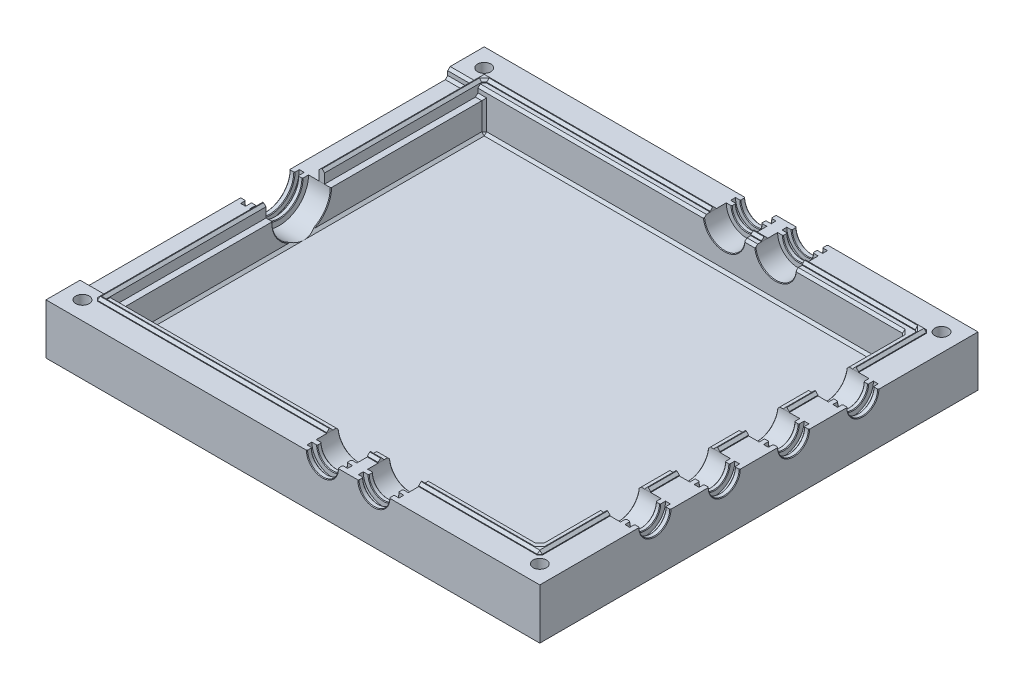
from build123d import *

# Parameters (mm, degrees)
SKETCH1_W                      = 203.05
SKETCH1_H                      = 180.2
BOSS_EXTRUDE1_DEPTH            = 5
SKETCH2_W                      = 15
SKETCH2_H                      = 150.2
BOSS_EXTRUDE2_DEPTH            = 12.05
BOSS_EXTRUDE3_START            = 12.05
BOSS_EXTRUDE3_DEPTH            = 3.7
M5_CLEARANCE_HOLE1_D           = 5.5
M5_CLEARANCE_HOLE1_DEPTH       = 20.75
M5_CLEARANCE_HOLE1_TIP         = 1.652366702
BOSS_EXTRUDE4_START            = -3.7
SKETCH9_W                      = 182.85
SKETCH9_H                      = 160
SKETCH9_W_2                    = 178.25
SKETCH9_H_2                    = 155.4
BOSS_EXTRUDE4_DEPTH            = 5
CHAMFER1_SIZE                  = 1
CUT_EXTRUDE1_DEPTH             = 263.69096863
CUT_EXTRUDE1_DEPTH_BACK        = 263.69096863
SKETCH11_R                     = 12.05
CUT_EXTRUDE2_DEPTH             = 262.382947034
CUT_EXTRUDE2_DIRECTION_2_REACH = 263.383
CUT_EXTRUDE3_START             = 173.05
SKETCH11_3_R                   = 8.35
CUT_EXTRUDE3_DEPTH             = 89.332947034
CUT_EXTRUDE4_START             = -12.4
SKETCH12_W                     = 16.7
SKETCH12_H                     = 1.3
CUT_EXTRUDE4_DEPTH             = 2.3
CUT_EXTRUDE5_START             = -12.4
SKETCH13_W                     = 24.1
SKETCH13_H                     = 5
CUT_EXTRUDE5_DEPTH             = 2.3
SKETCH14_W                     = 2.215
SKETCH14_H                     = 1.8
SKETCH14_W_2                   = 2
SKETCH14_H_2                   = 2
REVOLVE1_ANGLE                 = 180
LPATTERN1_COUNT                = 2
LPATTERN1_PITCH                = 21.12
MIRROR1_COPY_1_SKETCH_W        = 2.215
MIRROR1_COPY_1_SKETCH_H        = 1.8
MIRROR1_COPY_1_SKETCH_W_2      = 2
MIRROR1_COPY_1_SKETCH_H_2      = 2
MIRROR1_COPY_1_ANGLE           = 180
SKETCH15_W                     = 2
SKETCH15_H                     = 2
SKETCH15_W_2                   = 1.8
SKETCH15_H_2                   = 2.215
REVOLVE2_ANGLE                 = 180
LPATTERN2_COUNT                = 3
LPATTERN2_PITCH                = 28.5
LPATTERN2_COL_COUNT            = 2
LPATTERN2_COL_PITCH            = 28.5
SKETCH16_W                     = 2
SKETCH16_H                     = 2
SKETCH16_W_2                   = 1.8
SKETCH16_H_2                   = 2.475
REVOLVE3_ANGLE                 = 180
CHAMFER2_SIZE                  = 0.25


with BuildPart() as part:
    # Sketch1 → Boss-Extrude1 (new body)
    with BuildSketch(Plane(origin=(0, 0, 0), x_dir=(1, 0, 0), z_dir=(0, 1, 0))):
        with Locations((101.525, 90.1)):
            Rectangle(SKETCH1_W, SKETCH1_H)
    extrude(amount=BOSS_EXTRUDE1_DEPTH)

    # Sketch2 → Boss-Extrude2 (add)
    with BuildSketch(Plane(origin=(0, 5, 0), x_dir=(1, 0, 0), z_dir=(0, 1, 0))):
        Polygon((188.05, 15), (15, 15), (0, 15), (0, 0), (203.05, 0), (203.05, 180.2), (0, 180.2), (0, 165.2), (15, 165.2), (188.05, 165.2), align=None)
        with Locations((7.5, 90.1)):
            Rectangle(SKETCH2_W, SKETCH2_H)
    extrude(amount=BOSS_EXTRUDE2_DEPTH)

    # Sketch2<3> → Boss-Extrude3 (add)
    with BuildSketch(Plane(origin=(0, 5, 0), x_dir=(1, 0, 0), z_dir=(0, 1, 0)).offset(BOSS_EXTRUDE3_START)):
        Polygon((188.05, 15), (15, 15), (0, 15), (0, 0), (203.05, 0), (203.05, 180.2), (0, 180.2), (0, 165.2), (15, 165.2), (188.05, 165.2), align=None)
    extrude(amount=BOSS_EXTRUDE3_DEPTH)

    # M5 Clearance Hole1
    with Locations(Plane(origin=(0, 20.75, 0), x_dir=(1, 0, 0), z_dir=(0, 1, 0))):
        with Locations((7.5, 172.7), (195.55, 172.7), (195.55, 7.5), (7.5, 7.5)):
            Hole(M5_CLEARANCE_HOLE1_D / 2, depth=M5_CLEARANCE_HOLE1_DEPTH)
            with Locations((0, 0, -(M5_CLEARANCE_HOLE1_DEPTH + M5_CLEARANCE_HOLE1_TIP / 2))):  # 118° drill point
                Cone(0, M5_CLEARANCE_HOLE1_D / 2, M5_CLEARANCE_HOLE1_TIP, mode=Mode.SUBTRACT)

    # Sketch9 → Boss-Extrude4 (add)
    with BuildSketch(Plane(origin=(0, 20.75, 0), x_dir=(1, 0, 0), z_dir=(0, 1, 0)).offset(BOSS_EXTRUDE4_START)):
        with Locations((101.525, 90.1)):
            Rectangle(SKETCH9_W, SKETCH9_H)
        with Locations((101.525, 90.1)):
            Rectangle(SKETCH9_W_2, SKETCH9_H_2, mode=Mode.SUBTRACT)
    extrude(amount=BOSS_EXTRUDE4_DEPTH)

    # Chamfer1
    chamfer1_edges = [part.edges().sort_by_distance(p)[0] for p in [
        (13.7, 17.05, -165.2),
        (5.05, 17.05, -15),
        (192.95, 21.4, -170.1),
        (10.1, 21.4, -10.1),
        (192.95, 21.4, -10.1),
        (101.525, 22.05, -167.8),
        (12.4, 21.4, -167.8),
        (101.525, 22.05, -12.4),
        (190.65, 21.4, -12.4),
        (190.65, 22.05, -90.1),
        (190.65, 21.4, -167.8),
        (101.525, 22.05, -170.1),
        (10.1, 22.05, -90.1),
        (101.525, 22.05, -10.1),
        (192.95, 22.05, -90.1),
        (10.1, 21.4, -170.1),
        (12.4, 22.05, -90.1),
        (15, 11.025, -165.2),
        (188.05, 12.875, -165.2),
        (188.05, 12.875, -15),
        (15, 5, -90.1),
        (15, 11.025, -15),
        (101.525, 5, -165.2),
        (101.525, 5, -15),
        (188.05, 5, -90.1),
        (13.7, 17.05, -15),
        (5.05, 17.05, -165.2),
        (5.05, 20.75, -165.2),
        (188.05, 20.75, -90.1),
        (100.225, 20.75, -15),
        (100.225, 20.75, -165.2),
        (5.05, 20.75, -15),
    ]]
    chamfer(chamfer1_edges, length=CHAMFER1_SIZE)

    # Sketch10 → Cut-Extrude1 (cut, two sides: drawn at the far end of the back side and taken through both)
    with BuildSketch(Plane(origin=(0, 0, -15), x_dir=(-1, 0, 0), z_dir=(0, 0, -1)).offset(-CUT_EXTRUDE1_DEPTH_BACK)):
        with BuildLine():
            Line((-143.15, 20.75), (-143.15, 22.05))
            Line((-143.15, 22.05), (-126.45, 22.05))
            Line((-126.45, 22.05), (-126.45, 20.75))
            ThreePointArc((-126.45, 20.75), (-134.8, 12.4), (-143.15, 20.75))
        make_face()
        with BuildLine():
            Line((-122.03, 20.75), (-122.03, 22.05))
            Line((-122.03, 22.05), (-105.33, 22.05))
            Line((-105.33, 22.05), (-105.33, 20.75))
            ThreePointArc((-105.33, 20.75), (-113.68, 12.4), (-122.03, 20.75))
        make_face()
    extrude(amount=CUT_EXTRUDE1_DEPTH + CUT_EXTRUDE1_DEPTH_BACK, mode=Mode.SUBTRACT)

    # Sketch11 → Cut-Extrude2 (cut)
    with BuildSketch(Plane(origin=(15, 0, 0), x_dir=(0, 0, -1), z_dir=(1, 0, 0))):
        with Locations((90.1, 17.05)):
            Circle(SKETCH11_R)
    extrude(amount=-CUT_EXTRUDE2_DEPTH, mode=Mode.SUBTRACT)

    # Sketch11 → Cut-Extrude2 direction 2 (cut, up to next)
    with BuildSketch(Plane(origin=(15, 0, 0), x_dir=(0, 0, -1), z_dir=(1, 0, 0)), mode=Mode.PRIVATE) as cut_extrude2_direction_2_sk1:
        with Locations((90.1, 17.05)):
            Circle(SKETCH11_R)
    cut_extrude2_direction_2_tool1 = extrude(cut_extrude2_direction_2_sk1.sketch, amount=CUT_EXTRUDE2_DIRECTION_2_REACH, mode=Mode.PRIVATE) & part.part
    add(cut_extrude2_direction_2_tool1.solids().sort_by_distance((15, 17.05, -90.1))[0], mode=Mode.SUBTRACT)

    # Sketch11<3> → Cut-Extrude3 (cut, through all)
    with BuildSketch(Plane(origin=(15, 0, 0), x_dir=(0, 0, -1), z_dir=(1, 0, 0)).offset(CUT_EXTRUDE3_START)):
        with Locations((104.35, 20.75)):
            Circle(SKETCH11_3_R)
        with Locations((75.85, 20.75)):
            Circle(SKETCH11_3_R)
        with Locations((132.85, 20.75)):
            Circle(SKETCH11_3_R)
        with Locations((47.35, 20.75)):
            Circle(SKETCH11_3_R)
    extrude(amount=CUT_EXTRUDE3_DEPTH, mode=Mode.SUBTRACT)

    # Sketch12 → Cut-Extrude4 (cut)
    with BuildSketch(Plane(origin=(203.05, 0, 0), x_dir=(0, 0, -1), z_dir=(1, 0, 0)).offset(CUT_EXTRUDE4_START)):
        with Locations((75.85, 21.4)):
            Rectangle(SKETCH12_W, SKETCH12_H)
        with Locations((104.35, 21.4)):
            Rectangle(SKETCH12_W, SKETCH12_H)
        with Locations((47.35, 21.4)):
            Rectangle(SKETCH12_W, SKETCH12_H)
        with Locations((132.85, 21.4)):
            Rectangle(SKETCH12_W, SKETCH12_H)
    extrude(amount=CUT_EXTRUDE4_DEPTH, mode=Mode.SUBTRACT)

    # Sketch13 → Cut-Extrude5 (cut)
    with BuildSketch(Plane.ZY.offset(CUT_EXTRUDE5_START)):
        with Locations((-90.1, 19.55)):
            Rectangle(SKETCH13_W, SKETCH13_H)
    extrude(amount=CUT_EXTRUDE5_DEPTH, mode=Mode.SUBTRACT)

    # Sketch14 → Revolve1 (revolve)
    with BuildSketch(Plane(origin=(0, 20.75, 0), x_dir=(1, 0, 0), z_dir=(0, 1, 0))):
        with Locations((106.4375, 175.3)):
            Rectangle(SKETCH14_W, SKETCH14_H)
        with Locations((106.33, 179.2)):
            Rectangle(SKETCH14_W_2, SKETCH14_H_2)
    revolve1 = revolve(axis=Axis((113.68, 20.75, -180.2), (0, 0, 1)), revolution_arc=REVOLVE1_ANGLE)

    # LPattern1: Revolve1 ×2
    with Locations(*[(i * LPATTERN1_PITCH, 0, 0) for i in range(1, LPATTERN1_COUNT)]):
        add(revolve1)

    # Mirror1: Revolve1 across plane
    add(revolve1.mirror(Plane(origin=(0, 0, -90.1), x_dir=(1, 0, 0), z_dir=(0, 0, -1))))

    # Mirror1 copy 1 sketch → Mirror1 copy 1 (revolve)
    with BuildSketch(Plane(origin=(21.12, 20.75, -180.2), x_dir=(1, 0, 0), z_dir=(0, 1, 0))):
        with Locations((106.4375, -175.3)):
            Rectangle(MIRROR1_COPY_1_SKETCH_W, MIRROR1_COPY_1_SKETCH_H)
        with Locations((106.33, -179.2)):
            Rectangle(MIRROR1_COPY_1_SKETCH_W_2, MIRROR1_COPY_1_SKETCH_H_2)
    revolve(axis=Axis((134.8, 20.75, 0), (0, 0, 1)), revolution_arc=MIRROR1_COPY_1_ANGLE)

    # Sketch15 → Revolve2 (revolve)
    with BuildSketch(Plane(origin=(0, 20.75, 0), x_dir=(1, 0, 0), z_dir=(0, 1, 0))):
        with Locations((202.05, 111.7)):
            Rectangle(SKETCH15_W, SKETCH15_H)
        with Locations((198.15, 111.5925)):
            Rectangle(SKETCH15_W_2, SKETCH15_H_2)
    revolve2 = revolve(axis=Axis((203.05, 20.75, -104.35), (-1, 0, 0)), revolution_arc=REVOLVE2_ANGLE)

    # LPattern2: Revolve2 ×3
    with Locations(*[(0, 0, i * LPATTERN2_PITCH) for i in range(1, LPATTERN2_COUNT)]):
        add(revolve2)

    # LPattern2 col: Revolve2 ×2
    with Locations(*[(0, 0, -i * LPATTERN2_COL_PITCH) for i in range(1, LPATTERN2_COL_COUNT)]):
        add(revolve2)

    # Sketch16 → Revolve3 (revolve)
    with BuildSketch(Plane(origin=(0, 17.05, 0), x_dir=(1, 0, 0), z_dir=(0, 1, 0))):
        with Locations((1, 101.15)):
            Rectangle(SKETCH16_W, SKETCH16_H)
        with Locations((4.9, 100.9125)):
            Rectangle(SKETCH16_W_2, SKETCH16_H_2)
    revolve(axis=Axis((16, 17.05, -90.1), (-1, 0, 0)), revolution_arc=REVOLVE3_ANGLE)

    # Chamfer2
    chamfer2_edges = [part.edges().sort_by_distance(p)[0] for p in [
        (113.68, 12.4, -165.2),
        (113.68, 12.4, -15),
        (134.8, 12.4, -165.2),
        (134.8, 12.4, -15),
        (15, 10.443668322, -80.022357331),
        (15, 10.443668322, -100.177642669),
        (188.05, 12.4, -132.85),
        (188.05, 12.4, -47.35),
        (188.05, 12.4, -104.35),
        (188.05, 12.4, -75.85),
        (113.68, 14.615, -176.2),
        (113.68, 14.615, -174.4),
        (113.68, 14.4, -180.2),
        (113.68, 14.4, -178.2),
        (134.8, 14.615, -176.2),
        (134.8, 14.615, -174.4),
        (134.8, 14.4, -180.2),
        (134.8, 14.4, -178.2),
        (113.68, 14.615, -4),
        (113.68, 14.615, -5.8),
        (113.68, 14.4, 0),
        (113.68, 14.4, -2),
        (134.8, 14.615, -4),
        (134.8, 14.615, -5.8),
        (134.8, 14.4, 0),
        (134.8, 14.4, -2),
        (203.05, 14.4, -104.35),
        (201.05, 14.4, -104.35),
        (199.05, 14.615, -104.35),
        (197.25, 14.615, -104.35),
        (203.05, 14.4, -132.85),
        (201.05, 14.4, -132.85),
        (199.05, 14.615, -132.85),
        (197.25, 14.615, -132.85),
        (203.05, 14.4, -75.85),
        (201.05, 14.4, -75.85),
        (199.05, 14.615, -75.85),
        (197.25, 14.615, -75.85),
        (203.05, 14.4, -47.35),
        (201.05, 14.4, -47.35),
        (199.05, 14.615, -47.35),
        (197.25, 14.615, -47.35),
        (0, 7, -90.1),
        (2, 7, -90.1),
        (4, 7.475, -90.1),
        (5.8, 7.475, -90.1),
    ]]
    chamfer(chamfer2_edges, length=CHAMFER2_SIZE)


solid = part.part
